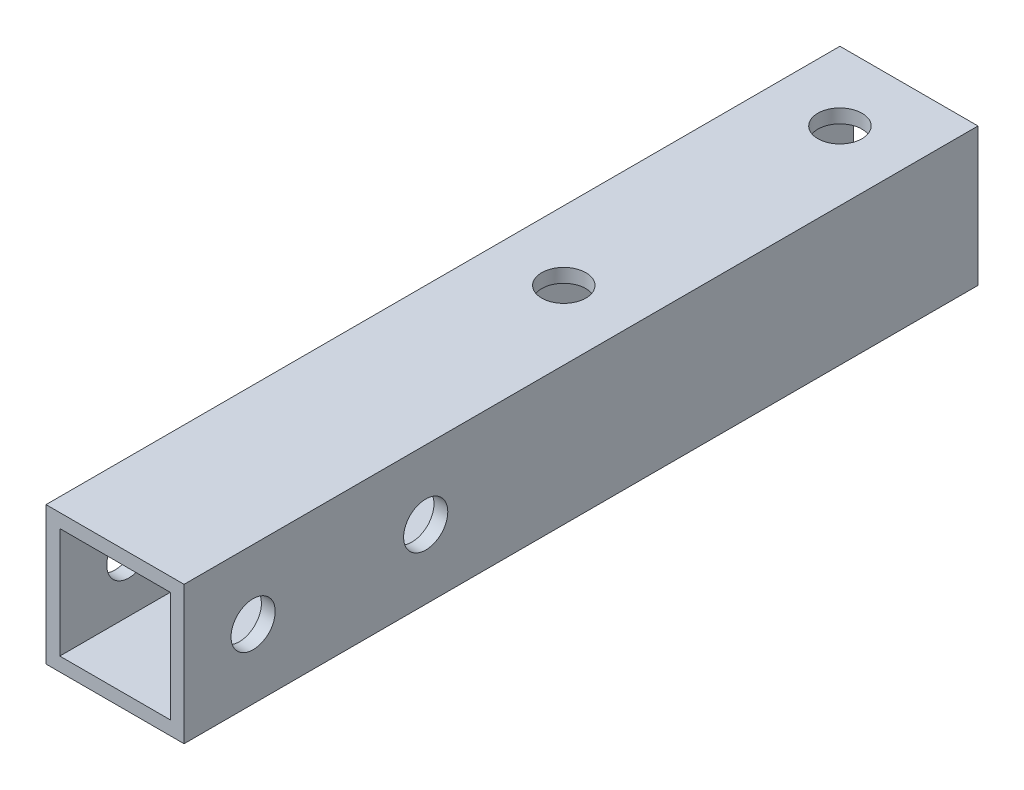
from build123d import *

# Parameters (mm, degrees)
SKETCH_1_W          = 10
SKETCH_1_H          = 10
SKETCH_1_W_2        = 8
SKETCH_1_H_2        = 8
EXTRUDE_1_DEPTH     = 57.5
SKETCH_2_R          = 1.6
CUT_EXTRUDE_1_DEPTH = 59.576872569
CUT_EXTRUDE_2_DEPTH = 10


with BuildPart() as part:
    # ｽｹｯﾁ1 → 押し出し-薄板1 (new body)
    with BuildSketch(Plane.XY):
        Rectangle(SKETCH_1_W, SKETCH_1_H)
        Rectangle(SKETCH_1_W_2, SKETCH_1_H_2, mode=Mode.SUBTRACT)
    extrude(amount=EXTRUDE_1_DEPTH)

    # ｽｹｯﾁ2 → ｶｯﾄ - 押し出し1 (cut, through all)
    with BuildSketch(Plane(origin=(0, 5, 0), x_dir=(1, 0, 0), z_dir=(0, 1, 0))):
        with Locations(Location((0, -5, 0), (0, 0, 270))):
            Circle(SKETCH_2_R)
        with Locations(Location((0, -25, 0), (0, 0, 270))):
            Circle(SKETCH_2_R)
    extrude(amount=-CUT_EXTRUDE_1_DEPTH, mode=Mode.SUBTRACT)

    # ｽｹｯﾁ4 → ｶｯﾄ - 押し出し2 (cut)
    with BuildSketch(Plane(origin=(5, 0, 0), x_dir=(0, 0, -1), z_dir=(1, 0, 0))):
        with BuildLine():
            ThreePointArc((-38.4, 0), (-40, 1.6), (-41.6, 0))
            Line((-41.6, 0), (-38.4, 0))
        make_face()
        with BuildLine():
            Line((-38.4, 0), (-41.6, 0))
            ThreePointArc((-41.6, 0), (-40, -1.6), (-38.4, 0))
        make_face()
        with BuildLine():
            ThreePointArc((-50.9, 0), (-52.5, 1.6), (-54.1, 0))
            Line((-54.1, 0), (-50.9, 0))
        make_face()
        with BuildLine():
            Line((-50.9, 0), (-54.1, 0))
            ThreePointArc((-54.1, 0), (-52.5, -1.6), (-50.9, 0))
        make_face()
    extrude(amount=-CUT_EXTRUDE_2_DEPTH, mode=Mode.SUBTRACT)


solid = part.part
